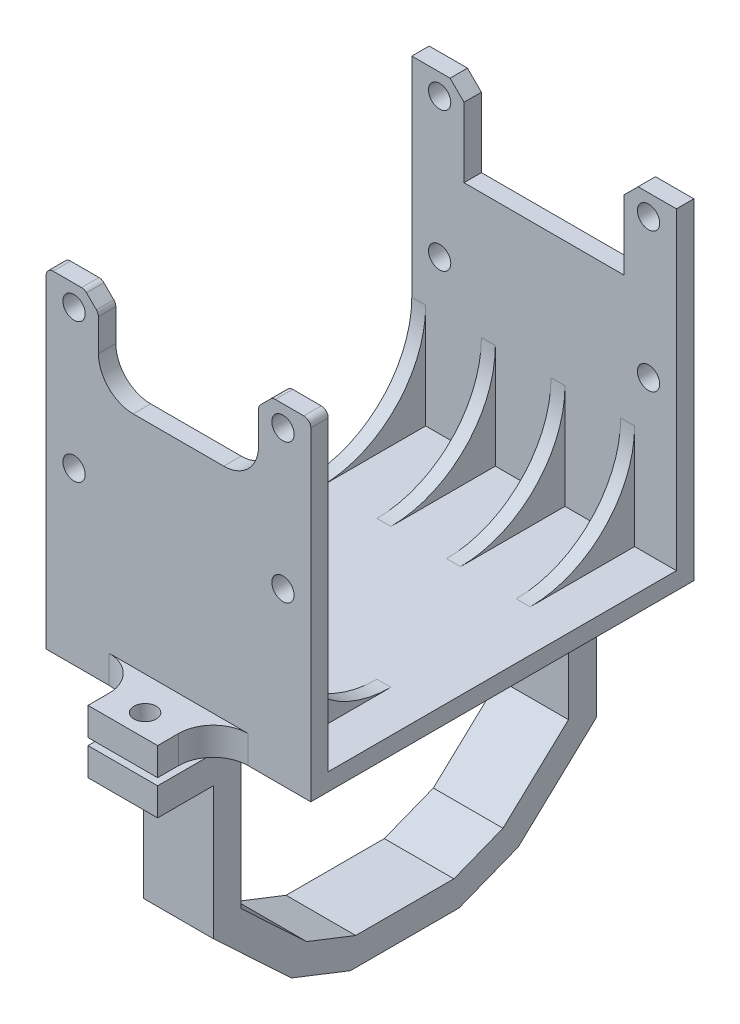
from build123d import *

# Parameters (mm, degrees)
SKETCH_1_W           = 38
SKETCH_1_H           = 45
SKETCH_1_R           = 1.6
EXTRUDE_1_DEPTH      = 2.5
CUT_EXTRUDE_1_DEPTH  = 2.5
SKETCH_3_W           = 38
SKETCH_3_H           = 55
EXTRUDE_2_DEPTH      = 2.5
FILLET_3_R           = 1
FILLET1_R            = 5
EXTRUDE3_DEPTH       = 2
LPATTERN1_COUNT      = 4
LPATTERN1_PITCH      = 10
MIRROR3_COPY_1_DEPTH = 2
MIRROR3_COPY_2_DEPTH = 2
MIRROR3_COPY_3_DEPTH = 2
EXTRUDE4_DEPTH       = 5
EXTRUDE4_DEPTH_BACK  = 5
SKETCH5_W            = 8
SKETCH5_H            = 4
SKETCH6_R            = 1.6
CUT_EXTRUDE1_DEPTH   = 20
FILLET2_R            = 5
FILLET3_R            = 5


with BuildPart() as part:
    # 草图1 → 凸台-拉伸1 (new body)
    with BuildSketch(Plane.XY):
        with Locations((-0.320113314, 1.635589826)):
            Rectangle(SKETCH_1_W, SKETCH_1_H)
        with Locations((-15.320113314, 21.135589826)):
            Circle(SKETCH_1_R, mode=Mode.SUBTRACT)
        with Locations((14.679886686, 21.135589826)):
            Circle(SKETCH_1_R, mode=Mode.SUBTRACT)
        with Locations((-15.320113314, 1.135589826)):
            Circle(SKETCH_1_R, mode=Mode.SUBTRACT)
        with Locations((14.679886686, 1.135589826)):
            Circle(SKETCH_1_R, mode=Mode.SUBTRACT)
    extrude_1 = extrude(amount=EXTRUDE_1_DEPTH)

    # 草图2 → 切除-拉伸1 (cut)
    with BuildSketch(Plane.XY.offset(2.5)):
        Polygon((-11.820113314, 24.135589826), (11.179886686, 24.135589826), (13.179886686, 24.135589826), (11.179886686, 22.135589826), (11.179886686, 12.135589826), (-11.820113314, 12.135589826), (-11.820113314, 22.135589826), (-13.820113314, 24.135589826), align=None)
    cut_extrude_1 = extrude(amount=-CUT_EXTRUDE_1_DEPTH, mode=Mode.SUBTRACT)

    # 草图3 → 凸台-拉伸2 (add)
    with BuildSketch(Plane.XZ.offset(20.864410174)):
        with Locations((-0.320113314, -25)):
            Rectangle(SKETCH_3_W, SKETCH_3_H)
    extrude(amount=EXTRUDE_2_DEPTH)

    # 圆角3
    fillet_3_edges = [part.edges().sort_by_distance(p)[0] for p in [
        (-13.820113314, 24.135589826, 1.25),
        (13.179886686, 24.135589826, 1.25),
        (11.179886686, 22.135589826, 1.25),
        (-11.820113314, 22.135589826, 1.25),
        (-19.320113314, 24.135589826, 1.25),
        (18.679886686, 24.135589826, 1.25),
    ]]
    fillet(fillet_3_edges, radius=FILLET_3_R)

    # Fillet1
    fillet1_edges = [part.edges().sort_by_distance(p)[0] for p in [
        (11.179886686, 12.135589826, 1.25),
        (-11.820113314, 12.135589826, 1.25),
    ]]
    fillet(fillet1_edges, radius=FILLET1_R)

    # Sketch4 → Extrude3 (add)
    with BuildSketch(Plane.ZY.offset(19.320113314)):
        with BuildLine():
            Line((0, -5.864410174), (0, -20.864410174))
            Line((0, -20.864410174), (-15, -20.864410174))
            ThreePointArc((-15, -20.864410174), (-4.393398282, -16.471011892), (0, -5.864410174))
        make_face()
    extrude3 = extrude(amount=-EXTRUDE3_DEPTH)

    # Mirror1: 凸台-拉伸1 across plane
    add(extrude_1.mirror(Plane(origin=(0, 0, -25), x_dir=(1, 0, 0), z_dir=(0, 0, -1))))

    # Mirror2: 切除-拉伸1 across plane
    add(cut_extrude_1.mirror(Plane(origin=(0, 0, -25), x_dir=(1, 0, 0), z_dir=(0, 0, -1))), mode=Mode.SUBTRACT)

    # LPattern1: Extrude3 ×4
    with Locations(*[(i * LPATTERN1_PITCH, 0, 0) for i in range(1, LPATTERN1_COUNT)]):
        add(extrude3)

    # Mirror3: Extrude3 across plane
    add(extrude3.mirror(Plane(origin=(0, 0, -25), x_dir=(1, 0, 0), z_dir=(0, 0, -1))))

    # Mirror3 copy 1 sketch → Mirror3 copy 1 (add)
    with BuildSketch(Plane(origin=(-9.320113314, 0, -50), x_dir=(0, 0, -1), z_dir=(-1, 0, 0))):
        with BuildLine():
            Line((0, 5.864410174), (0, 20.864410174))
            Line((0, 20.864410174), (-15, 20.864410174))
            ThreePointArc((-15, 20.864410174), (-4.393398282, 16.471011892), (0, 5.864410174))
        make_face()
    extrude(amount=-MIRROR3_COPY_1_DEPTH)

    # Mirror3 copy 2 sketch → Mirror3 copy 2 (add)
    with BuildSketch(Plane(origin=(0.679886686, 0, -50), x_dir=(0, 0, -1), z_dir=(-1, 0, 0))):
        with BuildLine():
            Line((0, 5.864410174), (0, 20.864410174))
            Line((0, 20.864410174), (-15, 20.864410174))
            ThreePointArc((-15, 20.864410174), (-4.393398282, 16.471011892), (0, 5.864410174))
        make_face()
    extrude(amount=-MIRROR3_COPY_2_DEPTH)

    # Mirror3 copy 3 sketch → Mirror3 copy 3 (add)
    with BuildSketch(Plane(origin=(10.679886686, 0, -50), x_dir=(0, 0, -1), z_dir=(-1, 0, 0))):
        with BuildLine():
            Line((0, 5.864410174), (0, 20.864410174))
            Line((0, 20.864410174), (-15, 20.864410174))
            ThreePointArc((-15, 20.864410174), (-4.393398282, 16.471011892), (0, 5.864410174))
        make_face()
    extrude(amount=-MIRROR3_COPY_3_DEPTH)

    # Sketch5 → Extrude4 (add, two sides: drawn at the far end of the back side and taken through both)
    with BuildSketch(Plane.ZY.offset(0.320113314).offset(-EXTRUDE4_DEPTH_BACK)):
        Polygon((-48.5, -23.364410174), (-48.5, -45.648790241), (-39.095261683, -54.441591814), (-32.049269501, -57.2068117), (-17.950730499, -57.2068117), (-10.904738317, -54.441591814), (-1.5, -45.648790241), (-1.5, -24.364410174), (10.5, -24.364410174), (10.5, -28.364410174), (2.5, -28.364410174), (2.5, -47.384968523), (-8.731572968, -57.885738362), (-17.193922344, -61.2068117), (-32.806077656, -61.2068117), (-41.268427032, -57.885738362), (-52.5, -47.384968523), (-52.5, -23.364410174), align=None)
        with Locations((6.5, -21.364410174)):
            Rectangle(SKETCH5_W, SKETCH5_H)
    extrude(amount=EXTRUDE4_DEPTH + EXTRUDE4_DEPTH_BACK)

    # Sketch6 → Cut-Extrude1 (cut)
    with BuildSketch(Plane.XZ.offset(28.364410174)):
        with Locations(Location((-0.320113314, 7.3, 0), (0, 0, 270))):
            Circle(SKETCH6_R)
    extrude(amount=-CUT_EXTRUDE1_DEPTH, mode=Mode.SUBTRACT)

    # Fillet2
    fillet2_edges = [part.edges().sort_by_distance(p)[0] for p in [
        (4.679886686, -23.364410174, -50.5),
        (-5.320113314, -23.364410174, -50.5),
    ]]
    fillet(fillet2_edges, radius=FILLET2_R)

    # Fillet3
    fillet3_edges = [part.edges().sort_by_distance(p)[0] for p in [
        (4.679886686, -21.364410174, 2.5),
        (-5.320113314, -21.364410174, 2.5),
    ]]
    fillet(fillet3_edges, radius=FILLET3_R)


solid = part.part
